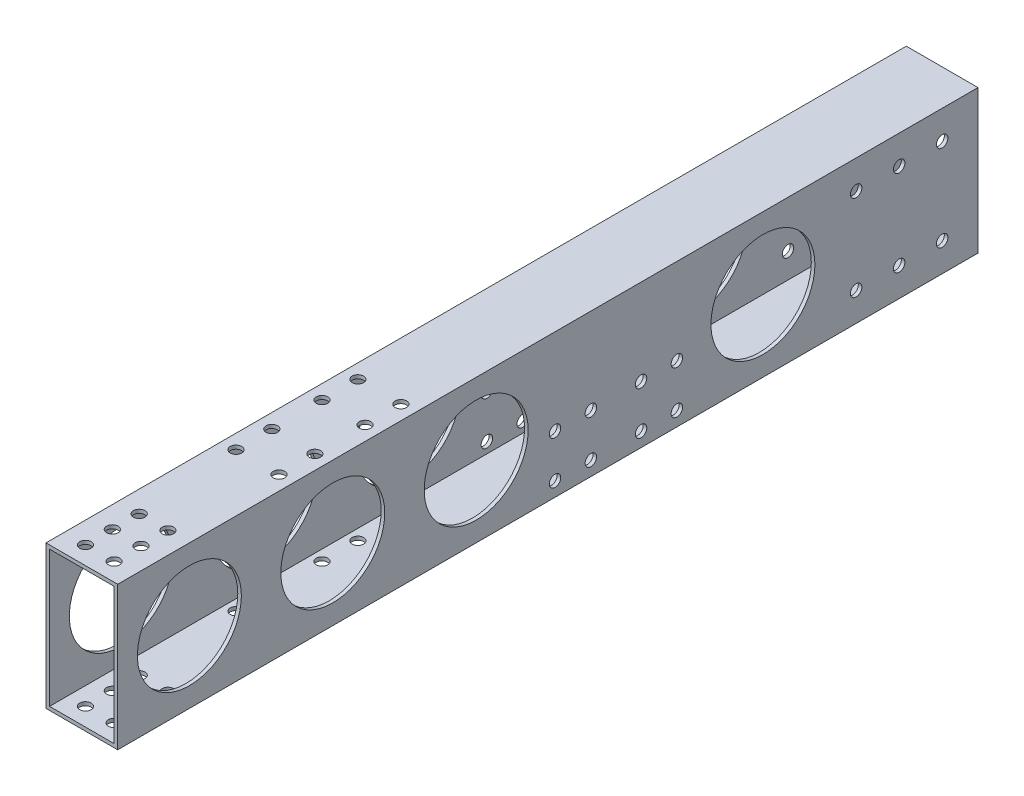
from build123d import *

# Parameters (mm, degrees)
SKETCH_1_W          = 20
SKETCH_1_H          = 40
SKETCH_1_W_2        = 18
SKETCH_1_H_2        = 38
EXTRUDE_1_DEPTH     = 240
SKETCH_2_R          = 1.6
CUT_EXTRUDE_1_DEPTH = 245.131112315
SKETCH_3_R          = 1.6
SKETCH_3_R_2        = 1.599999999
CUT_EXTRUDE_2_DEPTH = 245.131112315
SKETCH_4_R          = 14.5
CUT_EXTRUDE_3_DEPTH = 245.131112315


with BuildPart() as part:
    # 草图1 → 凸台-拉伸1 (new body)
    with BuildSketch(Plane.XY):
        with Locations((10, 20)):
            Rectangle(SKETCH_1_W, SKETCH_1_H)
        with Locations((10, 20)):
            Rectangle(SKETCH_1_W_2, SKETCH_1_H_2, mode=Mode.SUBTRACT)
    extrude(amount=EXTRUDE_1_DEPTH)

    # 草图2 → 切除-拉伸1 (cut, through all)
    with BuildSketch(Plane(origin=(20, 0, 0), x_dir=(0, 0, -1), z_dir=(1, 0, 0))):
        with Locations((-10, 8)):
            Circle(SKETCH_2_R)
        with Locations((-34, 8)):
            Circle(SKETCH_2_R)
        with Locations((-84, 4.000000001)):
            Circle(SKETCH_2_R)
        with Locations((-94, 4.000000001)):
            Circle(SKETCH_2_R)
        with Locations((-108, 16.000000001)):
            Circle(SKETCH_2_R)
        with Locations((-118, 16.000000001)):
            Circle(SKETCH_2_R)
        with Locations((-108, 4.000000001)):
            Circle(SKETCH_2_R)
        with Locations((-118, 4.000000001)):
            Circle(SKETCH_2_R)
        with Locations((-84, 16.000000001)):
            Circle(SKETCH_2_R)
        with Locations((-94, 16.000000001)):
            Circle(SKETCH_2_R)
        with Locations((-10, 32)):
            Circle(SKETCH_2_R)
        with Locations((-34, 32)):
            Circle(SKETCH_2_R)
        with Locations((-22, 32)):
            Circle(SKETCH_2_R)
        with Locations((-22, 8)):
            Circle(SKETCH_2_R)
    extrude(amount=-CUT_EXTRUDE_1_DEPTH, mode=Mode.SUBTRACT)

    # 草图3 → 切除-拉伸2 (cut, through all)
    with BuildSketch(Plane(origin=(0, 40, 0), x_dir=(1, 0, 0), z_dir=(0, 1, 0))):
        with Locations(Location((6, -227.5, 0), (0, 0, 270))):
            Circle(SKETCH_3_R)
        with Locations(Location((14, -227.5, 0), (0, 0, 270))):
            Circle(SKETCH_3_R)
        with Locations(Location((16.000000001, -191.000000001, 0), (0, 0, 270))):
            Circle(SKETCH_3_R_2)
        with Locations(Location((16.000000001, -181.000000001, 0), (0, 0, 270))):
            Circle(SKETCH_3_R_2)
        with Locations(Location((4.000000001, -167.000000001, 0), (0, 0, 270))):
            Circle(SKETCH_3_R_2)
        with Locations(Location((4.000000001, -157.000000001, 0), (0, 0, 270))):
            Circle(SKETCH_3_R_2)
        with Locations(Location((16.000000001, -167.000000001, 0), (0, 0, 270))):
            Circle(SKETCH_3_R_2)
        with Locations(Location((16.000000001, -157.000000001, 0), (0, 0, 270))):
            Circle(SKETCH_3_R_2)
        with Locations(Location((4.000000001, -191.000000001, 0), (0, 0, 270))):
            Circle(SKETCH_3_R_2)
        with Locations(Location((4.000000001, -181.000000001, 0), (0, 0, 270))):
            Circle(SKETCH_3_R_2)
        with Locations(Location((6, -220, 0), (0, 0, 270))):
            Circle(SKETCH_3_R)
        with Locations(Location((14, -220, 0), (0, 0, 270))):
            Circle(SKETCH_3_R)
        with Locations(Location((6, -235, 0), (0, 0, 270))):
            Circle(SKETCH_3_R)
        with Locations(Location((14, -235, 0), (0, 0, 270))):
            Circle(SKETCH_3_R)
    extrude(amount=-CUT_EXTRUDE_2_DEPTH, mode=Mode.SUBTRACT)

    # 草图4 → 切除-拉伸3 (cut, through all)
    with BuildSketch(Plane(origin=(20, 0, 0), x_dir=(0, 0, -1), z_dir=(1, 0, 0))):
        with Locations((-220, 20)):
            Circle(SKETCH_4_R)
        with Locations((-180, 20)):
            Circle(SKETCH_4_R)
        with Locations((-140, 20)):
            Circle(SKETCH_4_R)
        with Locations((-60, 20)):
            Circle(SKETCH_4_R)
    extrude(amount=-CUT_EXTRUDE_3_DEPTH, mode=Mode.SUBTRACT)


solid = part.part
